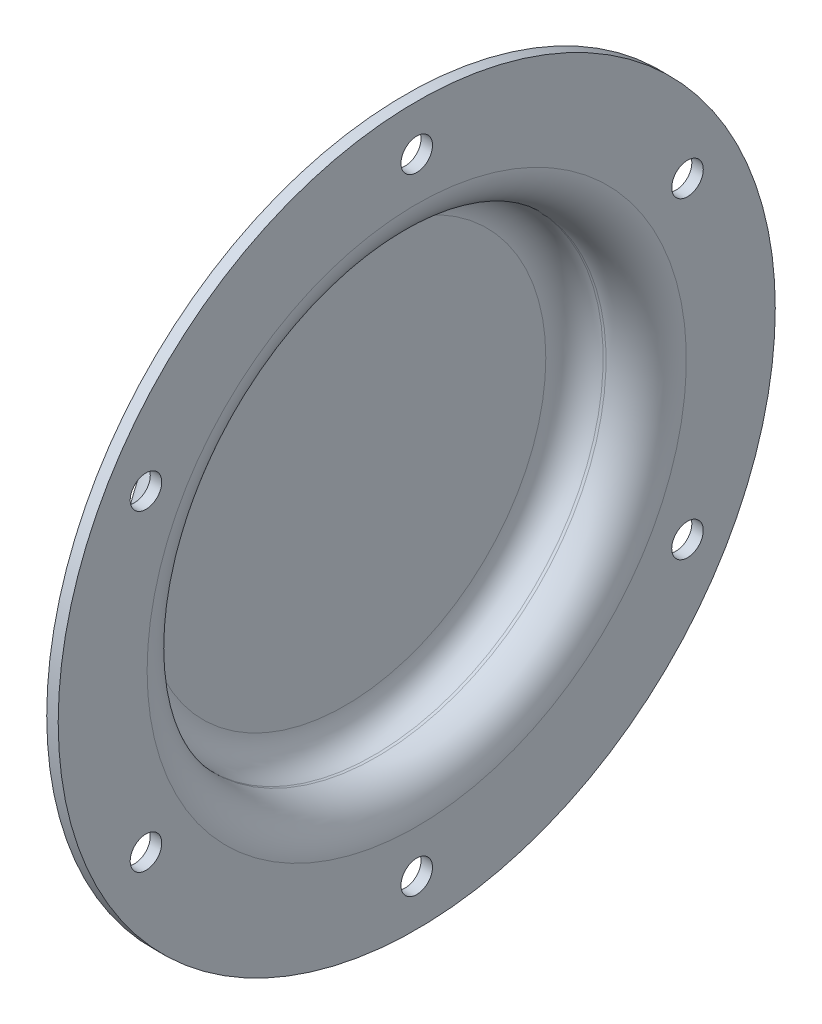
from build123d import *

# Parameters (mm, degrees)
SKETCH2_R          = 5.5
CUT_EXTRUDE1_DEPTH = 179.535710728
CIRPATTERN1_COUNT  = 6


with BuildPart() as part:
    # Sketch1 → Revolve1 (revolve)
    with BuildSketch(Plane.XY, mode=Mode.PRIVATE) as revolve1_sk:
        with BuildLine():
            Line((0, 0), (0, 70))
            ThreePointArc((0, 70), (2.928932188, 77.071067812), (10, 80))
            Line((10, 80), (11, 80))
            ThreePointArc((11, 80), (20.899494937, 84.100505063), (25, 94))
            Line((25, 94), (25, 125))
            Line((25, 125), (21, 125))
            Line((21, 125), (21, 94))
            ThreePointArc((21, 94), (18.071067812, 86.928932188), (11, 84))
            Line((11, 84), (10, 84))
            ThreePointArc((10, 84), (0.100505063, 79.899494937), (-4, 70))
            Line((-4, 70), (-4, 0))
            Line((-4, 0), (0, 0))
        make_face()
    revolve(revolve1_sk.sketch.rotate(Axis((-4, 0, 0), (1, 0, 0)), 90), axis=Axis((-4, 0, 0), (1, 0, 0)))

    # Sketch2 → Cut-Extrude1 (cut, through all)
    with BuildSketch(Plane.ZY.offset(-21)):
        with Locations((0, 109)):
            Circle(SKETCH2_R)
    cut_extrude1 = extrude(amount=-CUT_EXTRUDE1_DEPTH, mode=Mode.SUBTRACT)

    # CirPattern1: Cut-Extrude1 ×6 about axis
    cirpattern1_axis = Axis((0, 0, 0), (1, 0, 0))
    for i in range(1, CIRPATTERN1_COUNT):
        add(cut_extrude1.rotate(cirpattern1_axis, i * 360 / CIRPATTERN1_COUNT), mode=Mode.SUBTRACT)


solid = part.part
